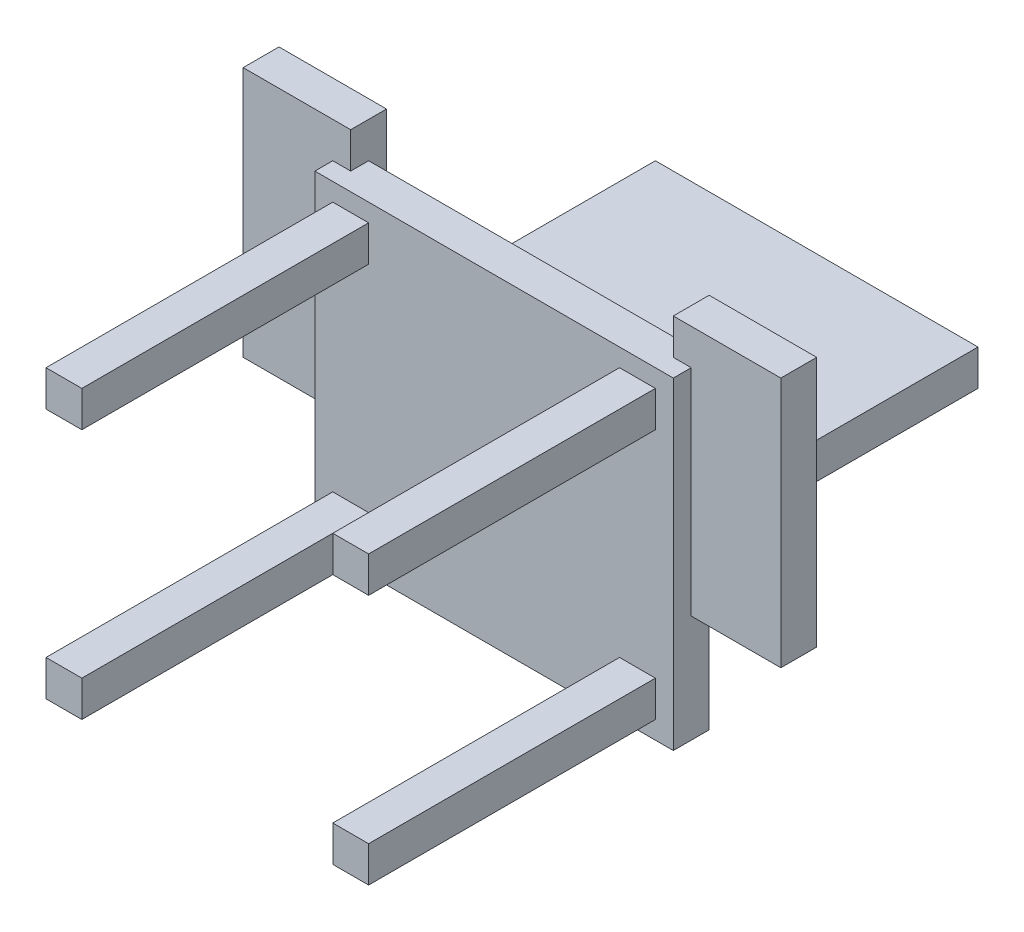
from build123d import *

# Parameters (mm, degrees)
SKETCH_1_W      = 500
SKETCH_1_H      = 450
EXTRUDE_1_DEPTH = 50
SKETCH_2_W      = 50
SKETCH_2_H      = 50
EXTRUDE_2_DEPTH = 450
SKETCH_3_W      = 50
SKETCH_3_H      = 50
EXTRUDE_3_DEPTH = 450
SKETCH_4_W      = 50
SKETCH_4_H      = 50
EXTRUDE_4_DEPTH = 450
SKETCH_5_W      = 50
SKETCH_5_H      = 50
EXTRUDE_5_DEPTH = 450
SKETCH_6_W      = 450
SKETCH_6_H      = 50
EXTRUDE_6_DEPTH = 400
SKETCH_7_W      = 50
SKETCH_7_H      = 350
EXTRUDE_7_DEPTH = 150
SKETCH_8_W      = 50
SKETCH_8_H      = 350
EXTRUDE_8_DEPTH = 150


with BuildPart() as part:
    # 草图1 → 凸台-拉伸1 (new body)
    with BuildSketch(Plane.XY):
        Rectangle(SKETCH_1_W, SKETCH_1_H)
    extrude(amount=EXTRUDE_1_DEPTH)

    # 草图2 → 凸台-拉伸2 (add)
    with BuildSketch(Plane.XY):
        with Locations((-200, -175)):
            Rectangle(SKETCH_2_W, SKETCH_2_H)
    extrude(amount=EXTRUDE_2_DEPTH)

    # 草图3 → 凸台-拉伸3 (add)
    with BuildSketch(Plane.XY):
        with Locations((200, -175)):
            Rectangle(SKETCH_3_W, SKETCH_3_H)
    extrude(amount=EXTRUDE_3_DEPTH)

    # 草图4 → 凸台-拉伸4 (add)
    with BuildSketch(Plane.XY):
        with Locations((-200, 175)):
            Rectangle(SKETCH_4_W, SKETCH_4_H)
    extrude(amount=EXTRUDE_4_DEPTH)

    # 草图5 → 凸台-拉伸5 (add)
    with BuildSketch(Plane.XY):
        with Locations((200, 175)):
            Rectangle(SKETCH_5_W, SKETCH_5_H)
    extrude(amount=EXTRUDE_5_DEPTH)

    # 草图6 → 凸台-拉伸6 (add)
    with BuildSketch(Plane(origin=(0, 0, 0), x_dir=(-1, 0, 0), z_dir=(0, 0, -1))):
        Rectangle(SKETCH_6_W, SKETCH_6_H)
    extrude(amount=EXTRUDE_6_DEPTH)

    # 草图7 → 凸台-拉伸7 (add)
    with BuildSketch(Plane.ZY.offset(225)):
        with Locations((0, 100)):
            Rectangle(SKETCH_7_W, SKETCH_7_H)
    extrude(amount=EXTRUDE_7_DEPTH)

    # 草图8 → 凸台-拉伸8 (add)
    with BuildSketch(Plane(origin=(225, 0, 0), x_dir=(0, 0, -1), z_dir=(1, 0, 0))):
        with Locations((0, 100)):
            Rectangle(SKETCH_8_W, SKETCH_8_H)
    extrude(amount=EXTRUDE_8_DEPTH)


solid = part.part
